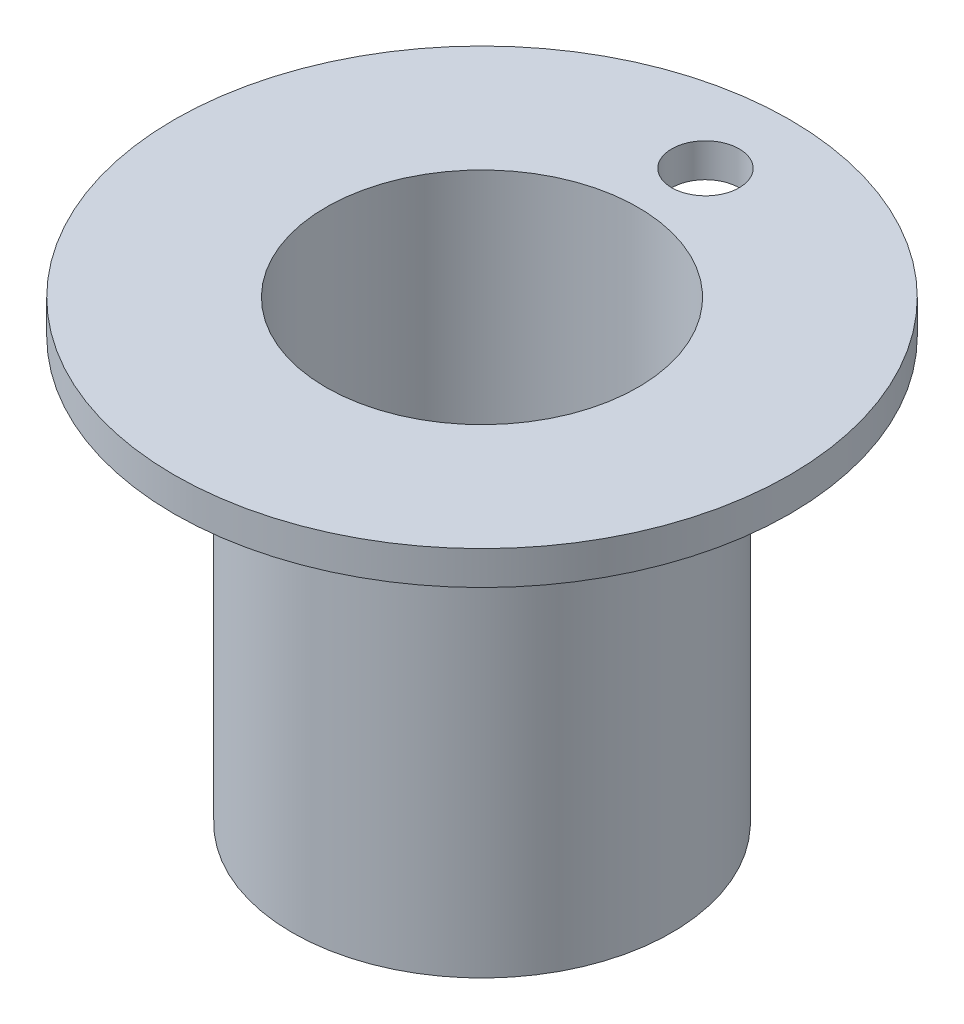
from build123d import *

# Parameters (mm, degrees)
SKETCH1_R           = 11.25
SKETCH1_R_2         = 9.25
BOSS_EXTRUDE1_DEPTH = 25
SKETCH2_R           = 18.25
SKETCH2_R_2         = 9.25
BOSS_EXTRUDE2_DEPTH = 2
SKETCH3_R           = 2
CUT_EXTRUDE1_DEPTH  = 2


with BuildPart() as part:
    # Sketch1 → Boss-Extrude1 (new body)
    with BuildSketch(Plane(origin=(0, 0, 0), x_dir=(1, 0, 0), z_dir=(0, 1, 0))):
        with Locations(Location((0, 0, 0), (0, 0, 270))):
            Circle(SKETCH1_R)
        with Locations(Location((0, 0, 0), (0, 0, 270))):
            Circle(SKETCH1_R_2, mode=Mode.SUBTRACT)
    extrude(amount=BOSS_EXTRUDE1_DEPTH)

    # Sketch2 → Boss-Extrude2 (add)
    with BuildSketch(Plane(origin=(0, 25, 0), x_dir=(1, 0, 0), z_dir=(0, 1, 0))):
        with Locations(Location((0, 0, 0), (0, 0, 270))):
            Circle(SKETCH2_R)
        with Locations(Location((0, 0, 0), (0, 0, 270))):
            Circle(SKETCH2_R_2, mode=Mode.SUBTRACT)
    extrude(amount=BOSS_EXTRUDE2_DEPTH)

    # Sketch3 → Cut-Extrude1 (cut)
    with BuildSketch(Plane(origin=(0, 27, 0), x_dir=(1, 0, 0), z_dir=(0, 1, 0))):
        with Locations(Location((0, 13.25, 0), (0, 0, 270))):
            Circle(SKETCH3_R)
    extrude(amount=-CUT_EXTRUDE1_DEPTH, mode=Mode.SUBTRACT)


solid = part.part
